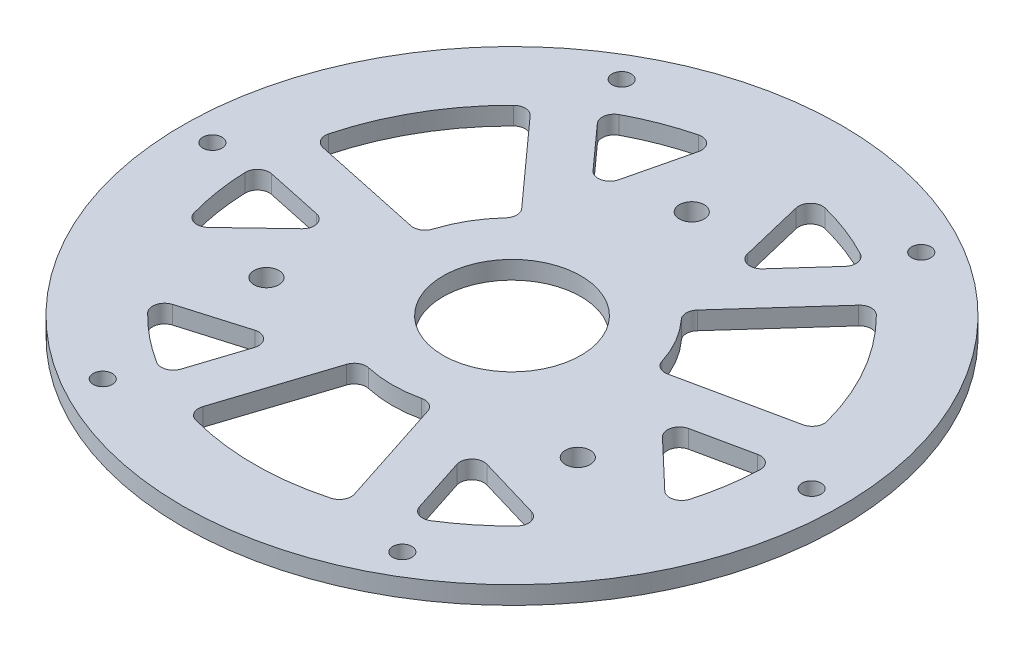
from build123d import *

# Parameters (mm, degrees)
SKETCH_1_R          = 55
SKETCH_1_R_2        = 11.5
SKETCH_1_R_3        = 2.075
SKETCH_1_R_4        = 1.6
EXTRUDE_1_DEPTH     = 3
CUT_EXTRUDE_1_REACH = 79.84
FILLET_1_R          = 2


with BuildPart() as part:
    # 草图1 → 凸台-拉伸1 (new body)
    with BuildSketch(Plane(origin=(0, 0, 0), x_dir=(1, 0, 0), z_dir=(0, 1, 0))):
        with Locations(Location((0, 0, 0), (0, 0, 270))):
            Circle(SKETCH_1_R)
        with Locations(Location((0, 0, 0), (0, 0, 270))):
            Circle(SKETCH_1_R_2, mode=Mode.SUBTRACT)
        with Locations(Location((0, 30, 0), (0, 0, 270))):
            Circle(SKETCH_1_R_3, mode=Mode.SUBTRACT)
        with Locations(Location((25.980762114, -15, 0), (0, 0, 270))):
            Circle(SKETCH_1_R_3, mode=Mode.SUBTRACT)
        with Locations(Location((-25.980762114, -15, 0), (0, 0, 270))):
            Circle(SKETCH_1_R_3, mode=Mode.SUBTRACT)
        with Locations(Location((25, 43.301270189, 0), (0, 0, 270))):
            Circle(SKETCH_1_R_4, mode=Mode.SUBTRACT)
        with Locations(Location((50, 0, 0), (0, 0, 270))):
            Circle(SKETCH_1_R_4, mode=Mode.SUBTRACT)
        with Locations(Location((25, -43.301270189, 0), (0, 0, 270))):
            Circle(SKETCH_1_R_4, mode=Mode.SUBTRACT)
        with Locations(Location((-25, -43.301270189, 0), (0, 0, 270))):
            Circle(SKETCH_1_R_4, mode=Mode.SUBTRACT)
        with Locations(Location((-50, 0, 0), (0, 0, 270))):
            Circle(SKETCH_1_R_4, mode=Mode.SUBTRACT)
        with Locations(Location((-25, 43.301270189, 0), (0, 0, 270))):
            Circle(SKETCH_1_R_4, mode=Mode.SUBTRACT)
        with BuildLine():
            Line((-13.382612127, 14.86289651), (-28.772616073, 31.955227496))
            ThreePointArc((-28.772616073, 31.955227496), (-37.239092363, 21.5), (-42.060346832, 8.940202705))
            Line((-42.060346832, 8.940202705), (-19.562952015, 4.158233816))
            ThreePointArc((-19.562952015, 4.158233816), (-17.320508076, 10), (-13.382612127, 14.86289651))
        make_face(mode=Mode.SUBTRACT)
        with BuildLine():
            Line((19.562952015, 4.158233816), (42.060346832, 8.940202705))
            ThreePointArc((42.060346832, 8.940202705), (37.239092363, 21.5), (28.772616073, 31.955227496))
            Line((28.772616073, 31.955227496), (13.382612127, 14.86289651))
            ThreePointArc((13.382612127, 14.86289651), (17.320508076, 10), (19.562952015, 4.158233816))
        make_face(mode=Mode.SUBTRACT)
        with BuildLine():
            Line((-6.180339887, -19.021130326), (-13.287730758, -40.895430201))
            ThreePointArc((-13.287730758, -40.895430201), (0, -43), (13.287730758, -40.895430201))
            Line((13.287730758, -40.895430201), (6.180339887, -19.021130326))
            ThreePointArc((6.180339887, -19.021130326), (0, -20), (-6.180339887, -19.021130326))
        make_face(mode=Mode.SUBTRACT)
    extrude(amount=EXTRUDE_1_DEPTH)

    # 草图3 → 切除-拉伸1 (cut, up to next)
    with BuildSketch(Plane(origin=(0, 3, 0), x_dir=(1, 0, 0), z_dir=(0, 1, 0)), mode=Mode.PRIVATE) as cut_extrude_1_sk1:
        with BuildLine():
            Line((-20.66067252, 34.901813864), (-14.159583627, 27.68162318))
            ThreePointArc((-14.159583627, 27.68162318), (-12.181948481, 27.081178741), (-10.729018032, 28.551065609))
            Line((-10.729018032, 28.551065609), (-8.14424004, 39.270605536))
            ThreePointArc((-8.14424004, 39.270605536), (-8.682815659, 41.162100176), (-10.580638715, 41.677932823))
            ThreePointArc((-10.580638715, 41.677932823), (-15.454508197, 40.126776302), (-20.109718619, 38.007883617))
            ThreePointArc((-20.109718619, 38.007883617), (-21.143642812, 36.589381929), (-20.66067252, 34.901813864))
        make_face()
    cut_extrude_1_tool1 = extrude(cut_extrude_1_sk1.sketch, amount=-CUT_EXTRUDE_1_REACH, mode=Mode.PRIVATE) & part.part
    # 草图3 → 切除-拉伸1 (cut, up to next)
    with BuildSketch(Plane(origin=(0, 3, 0), x_dir=(1, 0, 0), z_dir=(0, 1, 0)), mode=Mode.PRIVATE) as cut_extrude_1_sk2:
        with BuildLine():
            Line((8.14424004, 39.270605536), (10.729018032, 28.551065609))
            ThreePointArc((10.729018032, 28.551065609), (12.181948481, 27.081178741), (14.159583627, 27.68162318))
            Line((14.159583627, 27.68162318), (20.66067252, 34.901813864))
            ThreePointArc((20.66067252, 34.901813864), (21.143642812, 36.589381929), (20.109718619, 38.007883617))
            ThreePointArc((20.109718619, 38.007883617), (15.454508197, 40.126776302), (10.580638715, 41.677932823))
            ThreePointArc((10.580638715, 41.677932823), (8.682815659, 41.162100176), (8.14424004, 39.270605536))
        make_face()
    cut_extrude_1_tool2 = extrude(cut_extrude_1_sk2.sketch, amount=-CUT_EXTRUDE_1_REACH, mode=Mode.PRIVATE) & part.part
    # 草图3 → 切除-拉伸1 (cut, up to next)
    with BuildSketch(Plane(origin=(0, 3, 0), x_dir=(1, 0, 0), z_dir=(0, 1, 0)), mode=Mode.PRIVATE) as cut_extrude_1_sk3:
        with BuildLine():
            Line((40.556193705, 0.441760329), (31.052780705, -1.578252462))
            ThreePointArc((31.052780705, -1.578252462), (29.543962994, -2.990712518), (30.090457138, -4.983930631))
            Line((30.090457138, -4.983930631), (38.081462036, -12.582183999))
            ThreePointArc((38.081462036, -12.582183999), (39.988832255, -13.061511152), (41.384467959, -11.675864496))
            ThreePointArc((41.384467959, -11.675864496), (42.478061748, -6.679391449), (42.970652066, -1.588414622))
            ThreePointArc((42.970652066, -1.588414622), (42.259155666, 0.016240839), (40.556193705, 0.441760329))
        make_face()
    cut_extrude_1_tool3 = extrude(cut_extrude_1_sk3.sketch, amount=-CUT_EXTRUDE_1_REACH, mode=Mode.PRIVATE) & part.part
    # 草图3 → 切除-拉伸1 (cut, up to next)
    with BuildSketch(Plane(origin=(0, 3, 0), x_dir=(1, 0, 0), z_dir=(0, 1, 0)), mode=Mode.PRIVATE) as cut_extrude_1_sk4:
        with BuildLine():
            Line((29.937221996, -26.688421537), (19.361439106, -23.567134977))
            ThreePointArc((19.361439106, -23.567134977), (17.362014513, -24.090466222), (16.893197078, -26.103370718))
            Line((16.893197078, -26.103370718), (19.895521185, -35.343574194))
            ThreePointArc((19.895521185, -35.343574194), (21.115512854, -36.605622768), (22.860933447, -36.419468995))
            ThreePointArc((22.860933447, -36.419468995), (27.023553551, -33.447384853), (30.803829244, -30.002068327))
            ThreePointArc((30.803829244, -30.002068327), (31.306016597, -28.100589025), (29.937221996, -26.688421537))
        make_face()
    cut_extrude_1_tool4 = extrude(cut_extrude_1_sk4.sketch, amount=-CUT_EXTRUDE_1_REACH, mode=Mode.PRIVATE) & part.part
    # 草图3 → 切除-拉伸1 (cut, up to next)
    with BuildSketch(Plane(origin=(0, 3, 0), x_dir=(1, 0, 0), z_dir=(0, 1, 0)), mode=Mode.PRIVATE) as cut_extrude_1_sk5:
        with BuildLine():
            Line((-19.895521185, -35.343574194), (-16.893197078, -26.103370718))
            ThreePointArc((-16.893197078, -26.103370718), (-17.362014513, -24.090466222), (-19.361439106, -23.567134977))
            Line((-19.361439106, -23.567134977), (-29.937221996, -26.688421537))
            ThreePointArc((-29.937221996, -26.688421537), (-31.306016597, -28.100589025), (-30.803829244, -30.002068327))
            ThreePointArc((-30.803829244, -30.002068327), (-27.023553551, -33.447384853), (-22.860933447, -36.419468995))
            ThreePointArc((-22.860933447, -36.419468995), (-21.115512854, -36.605622768), (-19.895521185, -35.343574194))
        make_face()
    cut_extrude_1_tool5 = extrude(cut_extrude_1_sk5.sketch, amount=-CUT_EXTRUDE_1_REACH, mode=Mode.PRIVATE) & part.part
    # 草图3 → 切除-拉伸1 (cut, up to next)
    with BuildSketch(Plane(origin=(0, 3, 0), x_dir=(1, 0, 0), z_dir=(0, 1, 0)), mode=Mode.PRIVATE) as cut_extrude_1_sk6:
        with BuildLine():
            Line((-38.081462036, -12.582183999), (-30.090457138, -4.983930631))
            ThreePointArc((-30.090457138, -4.983930631), (-29.543962994, -2.990712518), (-31.052780705, -1.578252462))
            Line((-31.052780705, -1.578252462), (-40.556193705, 0.441760329))
            ThreePointArc((-40.556193705, 0.441760329), (-42.259155666, 0.016240839), (-42.970652066, -1.588414622))
            ThreePointArc((-42.970652066, -1.588414622), (-42.478061748, -6.679391449), (-41.384467959, -11.675864496))
            ThreePointArc((-41.384467959, -11.675864496), (-39.988832255, -13.061511152), (-38.081462036, -12.582183999))
        make_face()
    cut_extrude_1_tool6 = extrude(cut_extrude_1_sk6.sketch, amount=-CUT_EXTRUDE_1_REACH, mode=Mode.PRIVATE) & part.part
    add(cut_extrude_1_tool1.solids().sort_by_distance((-13.924139, 3, -35.062692))[0], mode=Mode.SUBTRACT)
    add(cut_extrude_1_tool2.solids().sort_by_distance((13.924139, 3, -35.062692))[0], mode=Mode.SUBTRACT)
    add(cut_extrude_1_tool3.solids().sort_by_distance((37.327251, 3, 5.472688))[0], mode=Mode.SUBTRACT)
    add(cut_extrude_1_tool4.solids().sort_by_distance((23.403112, 3, 29.590004))[0], mode=Mode.SUBTRACT)
    add(cut_extrude_1_tool5.solids().sort_by_distance((-23.403112, 3, 29.590004))[0], mode=Mode.SUBTRACT)
    add(cut_extrude_1_tool6.solids().sort_by_distance((-37.327251, 3, 5.472688))[0], mode=Mode.SUBTRACT)

    # 圆角1
    fillet_1_edges = [part.edges().sort_by_distance(p)[0] for p in [
        (-28.772616073, 1.5, -31.955227496),
        (-42.060346832, 1.5, -8.940202705),
        (-19.562952015, 1.5, -4.158233816),
        (-13.382612127, 1.5, -14.86289651),
        (42.060346832, 1.5, -8.940202705),
        (28.772616073, 1.5, -31.955227496),
        (13.382612127, 1.5, -14.86289651),
        (19.562952015, 1.5, -4.158233816),
        (-13.287730758, 1.5, 40.895430201),
        (13.287730758, 1.5, 40.895430201),
        (6.180339887, 1.5, 19.021130326),
        (-6.180339887, 1.5, 19.021130326),
    ]]
    fillet(fillet_1_edges, radius=FILLET_1_R)


solid = part.part
